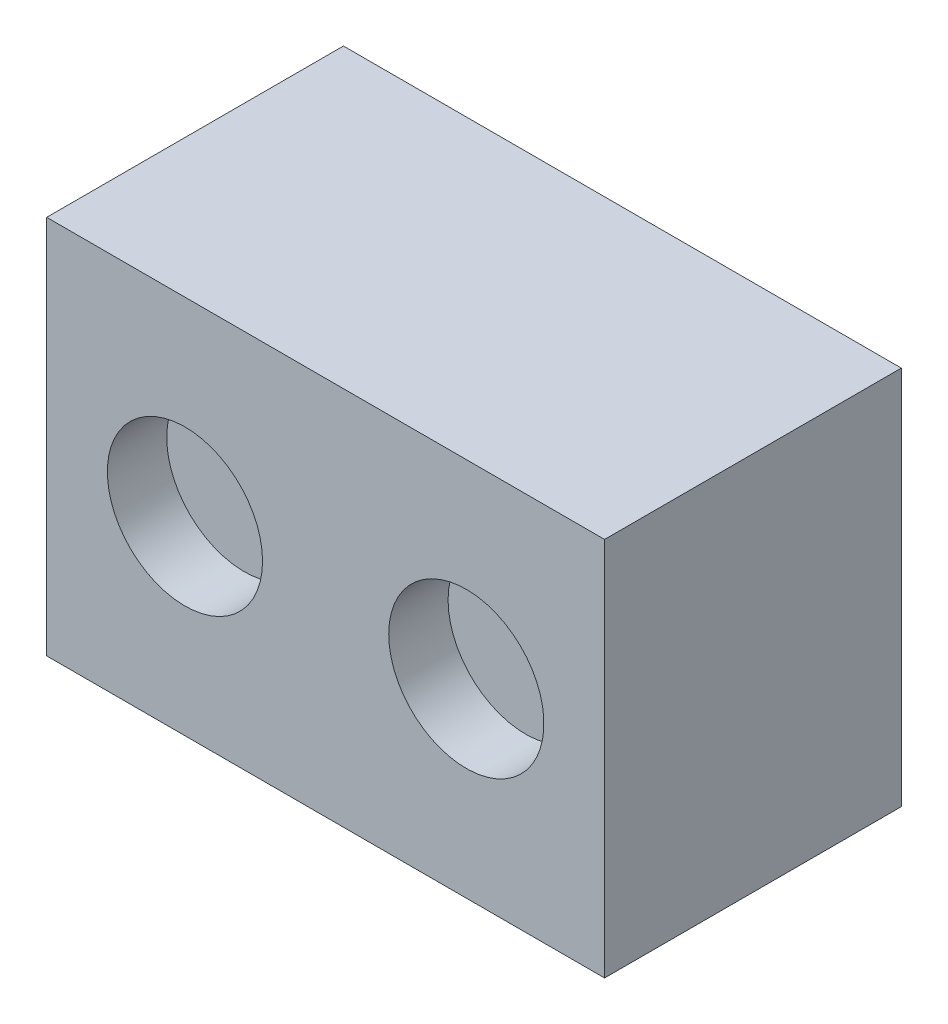
from build123d import *

# Parameters (mm, degrees)
CROQUIS1_W              = 18.8
CROQUIS1_H              = 12.8
SALIENTE_EXTRUIR1_DEPTH = 10
CROQUIS2_R              = 2.614642897
CORTAR_EXTRUIR1_DEPTH   = 2


with BuildPart() as part:
    # Croquis1 → Saliente-Extruir1 (new body)
    with BuildSketch(Plane.XY):
        Rectangle(CROQUIS1_W, CROQUIS1_H)
    extrude(amount=SALIENTE_EXTRUIR1_DEPTH)

    # Croquis2 → Cortar-Extruir1 (cut)
    with BuildSketch(Plane.XY.offset(10)):
        with Locations((-4.740668899, 0)):
            Circle(CROQUIS2_R)
    cortar_extruir1 = extrude(amount=-CORTAR_EXTRUIR1_DEPTH, mode=Mode.SUBTRACT)

    # Simetría1: Cortar-Extruir1 across plane
    add(cortar_extruir1.mirror(Plane(origin=(0, 0, 0), x_dir=(0, 0, 1), z_dir=(1, 0, 0))), mode=Mode.SUBTRACT)


solid = part.part
